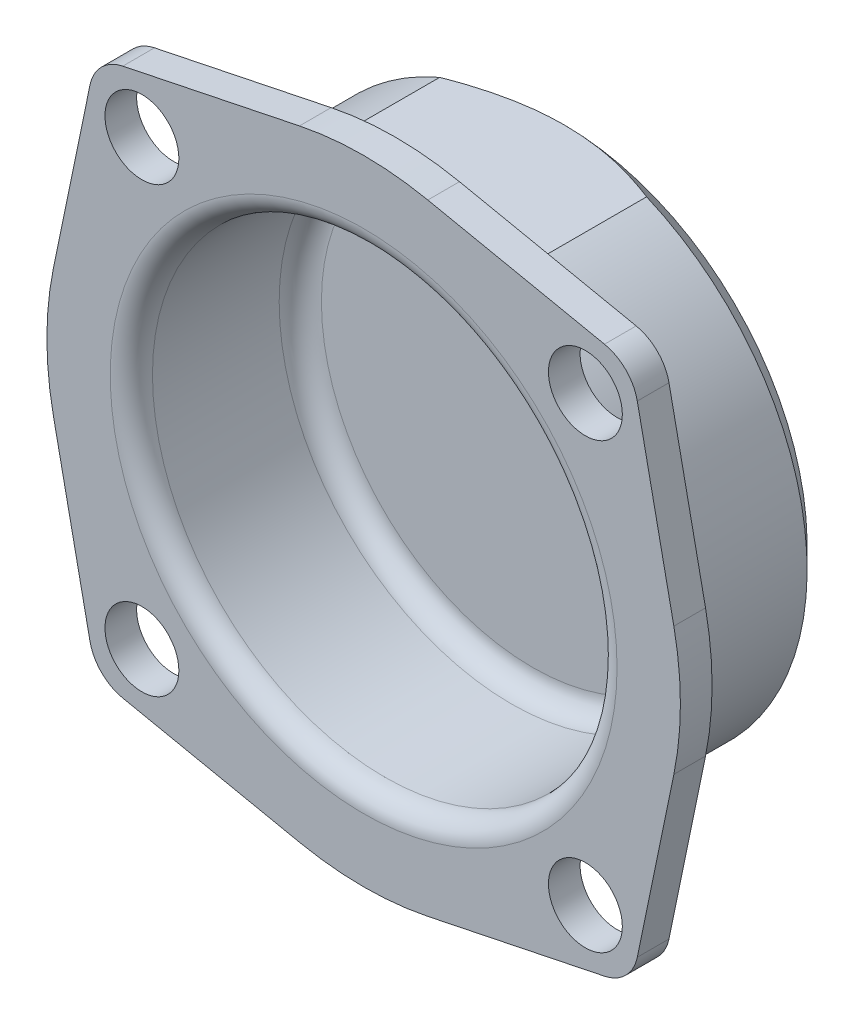
from build123d import *

# Parameters (mm, degrees)
ESQUISSE1_R             = 1.75
BASE_EXTRUSION_DEPTH    = 1.5
ESQUISSE2_R             = 12.5
BOSS_EXTRU_1_DEPTH      = 8
CHANFREIN1_SIZE         = 1
ESQUISSE3_R             = 11
ENL_V_MAT_EXTRU_1_DEPTH = 8
CONG_1_R                = 1
ESQUISSE4_W             = 15.143469624
ESQUISSE4_H             = 5.581450233
ENL_V_MAT_EXTRU_3_DEPTH = 8


with BuildPart() as part:
    # Esquisse1 → Base-Extrusion (new body)
    with BuildSketch(Plane.XY):
        with BuildLine():
            Line((-11.405090569, -12.958545795), (-3.038179265, -14.689093463))
            ThreePointArc((-3.038179265, -14.689093463), (0, -15), (3.038179265, -14.689093463))
            Line((3.038179265, -14.689093463), (11.405090569, -12.958545795))
            ThreePointArc((11.405090569, -12.958545795), (12.414213562, -12.414213562), (12.958545795, -11.405090569))
            Line((12.958545795, -11.405090569), (14.689093463, -3.038179265))
            ThreePointArc((14.689093463, -3.038179265), (15, 0), (14.689093463, 3.038179265))
            Line((14.689093463, 3.038179265), (12.958545795, 11.405090569))
            ThreePointArc((12.958545795, 11.405090569), (12.414213562, 12.414213562), (11.405090569, 12.958545795))
            Line((11.405090569, 12.958545795), (3.038179265, 14.689093463))
            ThreePointArc((3.038179265, 14.689093463), (0, 15), (-3.038179265, 14.689093463))
            Line((-3.038179265, 14.689093463), (-11.405090569, 12.958545795))
            ThreePointArc((-11.405090569, 12.958545795), (-12.414213562, 12.414213562), (-12.958545795, 11.405090569))
            Line((-12.958545795, 11.405090569), (-14.689093463, 3.038179265))
            ThreePointArc((-14.689093463, 3.038179265), (-15, 0), (-14.689093463, -3.038179265))
            Line((-14.689093463, -3.038179265), (-12.958545795, -11.405090569))
            ThreePointArc((-12.958545795, -11.405090569), (-12.414213562, -12.414213562), (-11.405090569, -12.958545795))
        make_face()
        with Locations((-10.5, 10.5)):
            Circle(ESQUISSE1_R, mode=Mode.SUBTRACT)
        with Locations((10.5, 10.5)):
            Circle(ESQUISSE1_R, mode=Mode.SUBTRACT)
        with Locations((-10.5, -10.5)):
            Circle(ESQUISSE1_R, mode=Mode.SUBTRACT)
        with Locations((10.5, -10.5)):
            Circle(ESQUISSE1_R, mode=Mode.SUBTRACT)
    extrude(amount=BASE_EXTRUSION_DEPTH)

    # Esquisse2 → Boss.-Extru.1 (add)
    with BuildSketch(Plane(origin=(0, 0, 0), x_dir=(-1, 0, 0), z_dir=(0, 0, -1))):
        with Locations(Location((0, 0, 0), (0, 0, 180))):
            Circle(ESQUISSE2_R)
    extrude(amount=BOSS_EXTRU_1_DEPTH)

    # Chanfrein1
    chanfrein1_edges = [part.edges().sort_by_distance(p)[0] for p in [
        (-12.5, 0, -8),
    ]]
    chamfer(chanfrein1_edges, length=CHANFREIN1_SIZE)

    # Esquisse3 → Enlèv. mat.-Extru.1 (cut)
    with BuildSketch(Plane.XY.offset(1.5)):
        Circle(ESQUISSE3_R)
    extrude(amount=-ENL_V_MAT_EXTRU_1_DEPTH, mode=Mode.SUBTRACT)

    # Congé1
    cong_1_edges = [part.edges().sort_by_distance(p)[0] for p in [
        (-11, 0, -6.5),
        (-11, 0, 1.5),
    ]]
    fillet(cong_1_edges, radius=CONG_1_R)

    # Esquisse4 → Enlèv. mat.-Extru.3 (cut)
    with BuildSketch(Plane(origin=(0, 0, 0), x_dir=(-1, 0, 0), z_dir=(0, 0, -1))):
        with Locations((-0.10816764, 14.290725117)):
            Rectangle(ESQUISSE4_W, ESQUISSE4_H)
    extrude(amount=ENL_V_MAT_EXTRU_3_DEPTH, mode=Mode.SUBTRACT)


solid = part.part
